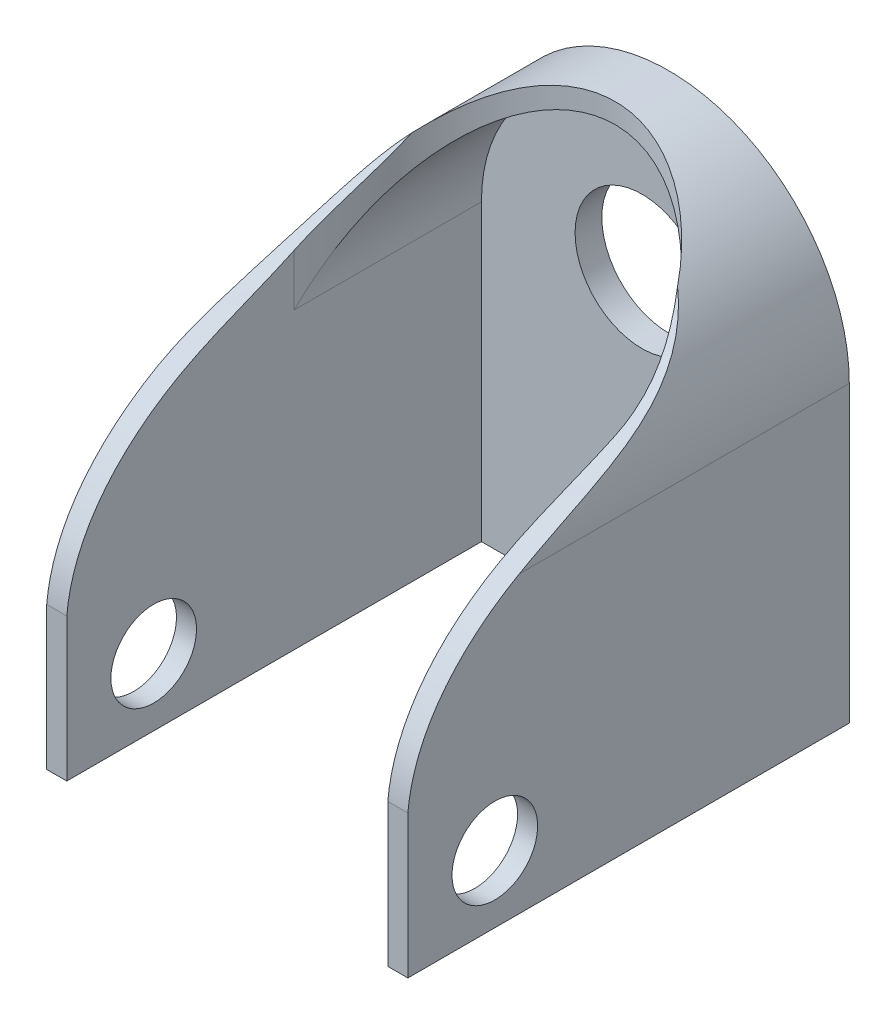
from build123d import *

# Parameters (mm, degrees)
BOSS_EXTRUDE1_DEPTH = 2
BOSS_EXTRUDE2_DEPTH = 31
CUT_EXTRUDE1_DEPTH  = 56.481979056
CUT_EXTRUDE2_DEPTH  = 56.481979228
SKETCH5_R           = 3.2
CUT_EXTRUDE3_DEPTH  = 56.481979228
SKETCH6_R           = 5
CUT_EXTRUDE4_DEPTH  = 56.481979228


with BuildPart() as part:
    # Sketch1 → Boss-Extrude1 (new body)
    with BuildSketch(Plane.XY):
        with BuildLine():
            Line((0, 0), (0, 22))
            ThreePointArc((0, 22), (13.5, 35.5), (27, 22))
            Line((27, 22), (27, 0))
            Line((27, 0), (0, 0))
        make_face()
    extrude(amount=BOSS_EXTRUDE1_DEPTH)

    # Sketch2 → Boss-Extrude2 (add)
    with BuildSketch(Plane.XY.offset(2)):
        with BuildLine():
            Line((27, 0), (27, 22))
            ThreePointArc((27, 22), (13.5, 35.5), (0, 22))
            Line((0, 22), (0, 0))
            Line((0, 0), (1.5, 0))
            Line((1.5, 0), (1.5, 1.5))
            Line((1.5, 1.5), (1.5, 22))
            ThreePointArc((1.5, 22), (13.5, 34), (25.5, 22))
            Line((25.5, 22), (25.5, 1.5))
            Line((25.5, 1.5), (25.5, 0))
            Line((25.5, 0), (27, 0))
        make_face()
    extrude(amount=BOSS_EXTRUDE2_DEPTH)

    # Sketch3 → Cut-Extrude1 (cut, through all)
    with BuildSketch(Plane(origin=(0, 0, 0), x_dir=(1, 0, 0), z_dir=(0, 1, 0))):
        with BuildLine():
            Line((1.5, -33), (1.5, -16))
            ThreePointArc((1.5, -16), (13.5, -4), (25.5, -16))
            Line((25.5, -16), (25.5, -33))
            Line((25.5, -33), (1.5, -33))
        make_face()
    extrude(amount=CUT_EXTRUDE1_DEPTH, mode=Mode.SUBTRACT)

    # Sketch4 → Cut-Extrude2 (cut, through all)
    with BuildSketch(Plane.ZY):
        with BuildLine():
            Line((33, 31.363603565), (9.117273512, 31.363603565))
            add(Edge.make_bspline(
                [(9.117273512, 31.363603565), (12.96325336, 25.746828887), (19.327266499, 25.020144715), (24.670979231, 22)],
                knots=[0, 0, 0, 0, 0.522970266, 0.522970266, 0.522970266, 0.522970266], degree=3))
            Line((24.670979231, 22), (33, 22))
            Line((33, 22), (33, 31.363603565))
        make_face()
        with BuildLine():
            Line((33, 22), (24.670979231, 22))
            add(Edge.make_bspline(
                [(24.670979231, 22), (28.91814661, 19.599597741), (32.520787743, 15.750410887), (33, 10.690145811)],
                knots=[0.522970266, 0.522970266, 0.522970266, 0.522970266, 0.938625516, 0.938625516, 0.938625516, 0.938625516], degree=3))
            Line((33, 10.690145811), (33, 22))
        make_face()
    extrude(amount=-CUT_EXTRUDE2_DEPTH, mode=Mode.SUBTRACT)

    # Sketch5 → Cut-Extrude3 (cut, through all)
    with BuildSketch(Plane.ZY):
        with Locations((26.5, 5)):
            Circle(SKETCH5_R)
    extrude(amount=-CUT_EXTRUDE3_DEPTH, mode=Mode.SUBTRACT)

    # Sketch6 → Cut-Extrude4 (cut, through all)
    with BuildSketch(Plane(origin=(0, 0, 0), x_dir=(-1, 0, 0), z_dir=(0, 0, -1))):
        with Locations((-13.5, 23.5)):
            Circle(SKETCH6_R)
    extrude(amount=-CUT_EXTRUDE4_DEPTH, mode=Mode.SUBTRACT)


solid = part.part
